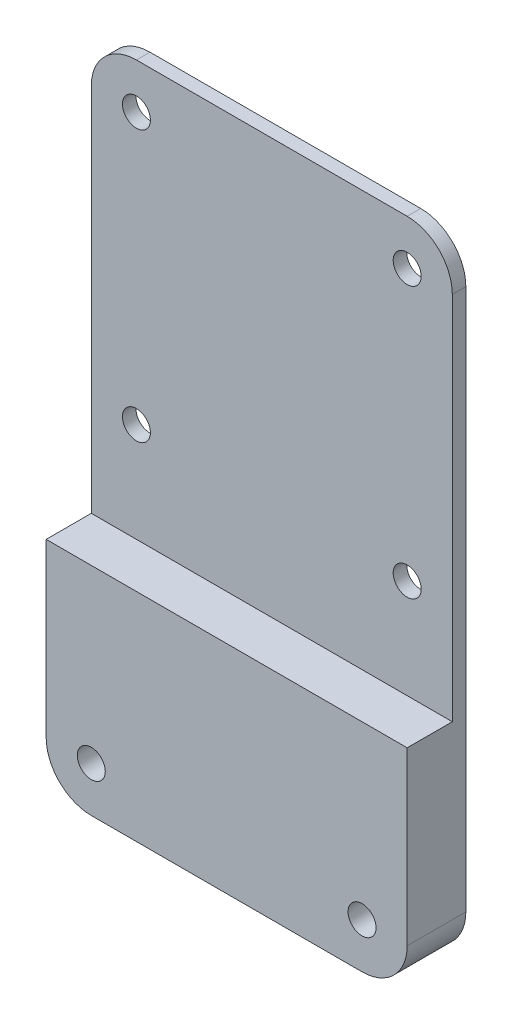
from build123d import *

# Parameters (mm, degrees)
SKETCH_1_W          = 40
SKETCH_1_H          = 70
SKETCH_1_R          = 1.55
EXTRUDE_1_DEPTH     = 1.5
SKETCH_2_W          = 40
SKETCH_2_H          = 24
EXTRUDE_2_DEPTH     = 5
SKETCH_3_R          = 1.55
CUT_EXTRUDE_1_DEPTH = 25
FILLET_1_R          = 5


with BuildPart() as part:
    # 草图1 → 凸台-拉伸1 (new body)
    with BuildSketch(Plane.XY):
        with Locations((20, -35)):
            Rectangle(SKETCH_1_W, SKETCH_1_H)
        with Locations((5, -5)):
            Circle(SKETCH_1_R, mode=Mode.SUBTRACT)
        with Locations((35, -5)):
            Circle(SKETCH_1_R, mode=Mode.SUBTRACT)
        with Locations((5, -35)):
            Circle(SKETCH_1_R, mode=Mode.SUBTRACT)
        with Locations((35, -35)):
            Circle(SKETCH_1_R, mode=Mode.SUBTRACT)
        with Locations((5, -65)):
            Circle(SKETCH_1_R, mode=Mode.SUBTRACT)
        with Locations((35, -65)):
            Circle(SKETCH_1_R, mode=Mode.SUBTRACT)
    extrude(amount=EXTRUDE_1_DEPTH)

    # 草图2 → 凸台-拉伸2 (add)
    with BuildSketch(Plane.XY.offset(1.5)):
        with Locations((20, -58)):
            Rectangle(SKETCH_2_W, SKETCH_2_H)
    extrude(amount=EXTRUDE_2_DEPTH)

    # 草图3 → 切除-拉伸1 (cut)
    with BuildSketch(Plane(origin=(0, 0, 1.5), x_dir=(-1, 0, 0), z_dir=(0, 0, -1))):
        with Locations(Location((-35, -65, 0), (0, 0, 180))):
            Circle(SKETCH_3_R)
        with Locations(Location((-5, -65, 0), (0, 0, 180))):
            Circle(SKETCH_3_R)
    extrude(amount=-CUT_EXTRUDE_1_DEPTH, mode=Mode.SUBTRACT)

    # 圆角1
    fillet_1_edges = [part.edges().sort_by_distance(p)[0] for p in [
        (0, 0, 0.75),
        (40, 0, 0.75),
        (40, -70, 3.25),
        (0, -70, 3.25),
    ]]
    fillet(fillet_1_edges, radius=FILLET_1_R)


solid = part.part
